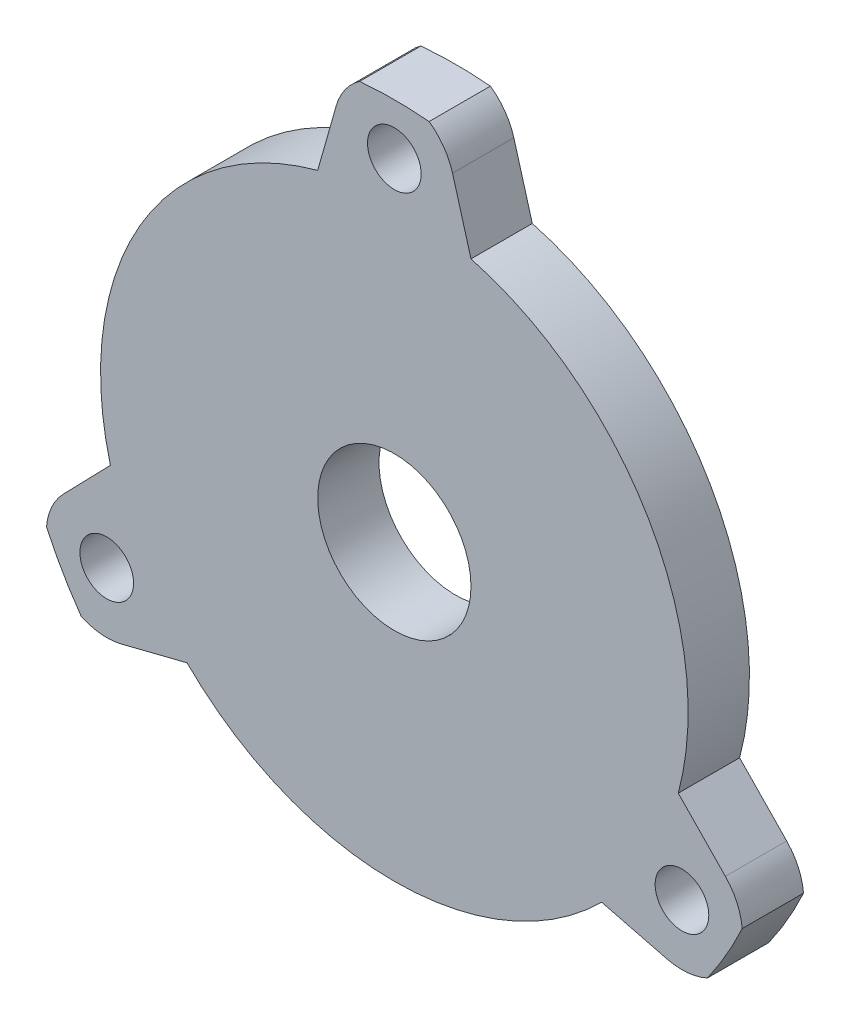
from build123d import *

# Parameters (mm, degrees)
ESBO_O1_R             = 75
ESBO_O1_R_2           = 15
EXTRUS_O1_DEPTH       = 6
ESBO_O2_R             = 5.25
CORTE_EXTRUS_O1_DEPTH = 107.742681248
CIRPATTERN1_COUNT     = 3
ESBO_O3_R             = 94.650975841
ESBO_O3_R_2           = 75
CORTE_EXTRUS_O3_DEPTH = 107.742681248


with BuildPart() as part:
    # Esboço1 → Extrusão1 (new, symmetric)
    with BuildSketch(Plane.XY):
        Circle(ESBO_O1_R)
        Circle(ESBO_O1_R_2, mode=Mode.SUBTRACT)
    extrude(amount=EXTRUS_O1_DEPTH, both=True)

    # Esboço2 → Corte-extrusão1 (cut, through all)
    with BuildSketch(Plane.XY.offset(6)):
        with Locations((0, 65)):
            Circle(ESBO_O2_R)
    corte_extrus_o1 = extrude(amount=-CORTE_EXTRUS_O1_DEPTH, mode=Mode.SUBTRACT)

    # CirPattern1: Corte-extrusão1 ×3 about axis
    cirpattern1_axis = Axis((0, 0, 0), (0, 0, 1))
    for i in range(1, CIRPATTERN1_COUNT):
        add(corte_extrus_o1.rotate(cirpattern1_axis, i * 360 / CIRPATTERN1_COUNT), mode=Mode.SUBTRACT)

    # Esboço3 → Corte-extrusão3 (cut, through all)
    # profile 1 of 4: a face of its own
    with BuildSketch(Plane.XY.offset(6)):
        Circle(ESBO_O3_R)
        Circle(ESBO_O3_R_2, mode=Mode.SUBTRACT)
    # profile 2 of 4: a face of its own
    with BuildSketch(Plane.XY.offset(6)):
        with BuildLine():
            ThreePointArc((-11.389775772, 68.231933262), (-9.651857518, 71.856677855), (-6.801268948, 74.690981656))
            ThreePointArc((-6.801268948, 74.690981656), (-64.951905284, 37.5), (-68.084922021, -31.455419141))
            ThreePointArc((-68.084922021, -31.455419141), (-67.055637213, -27.569585123), (-64.78547544, -24.252131468))
            Line((-64.78547544, -24.252131468), (-55.572211308, -14.764123082))
            ThreePointArc((-55.572211308, -14.764123082), (-49.796460718, 28.75), (-15, 55.509008278))
            Line((-15, 55.509008278), (-11.389775772, 68.231933262))
        make_face()
    # profile 3 of 4: a face of its own
    with BuildSketch(Plane.XY.offset(6)):
        with BuildLine():
            ThreePointArc((-53.395699668, -43.979801793), (-57.403779695, -44.287092732), (-61.283653073, -43.235562515))
            ThreePointArc((-61.283653073, -43.235562515), (0, -75), (61.283653073, -43.235562515))
            ThreePointArc((61.283653073, -43.235562515), (57.403779695, -44.287092732), (53.395699668, -43.979801793))
            Line((53.395699668, -43.979801793), (40.572211308, -40.744885196))
            ThreePointArc((40.572211308, -40.744885196), (0, -57.5), (-40.572211308, -40.744885196))
            Line((-40.572211308, -40.744885196), (-53.395699668, -43.979801793))
        make_face()
    # profile 4 of 4: a face of its own
    with BuildSketch(Plane.XY.offset(6)):
        with BuildLine():
            ThreePointArc((6.801268948, 74.690981656), (9.651857518, 71.856677855), (11.389775772, 68.231933262))
            Line((11.389775772, 68.231933262), (15, 55.509008278))
            ThreePointArc((15, 55.509008278), (45.654955919, 34.955328635), (57.5, 0))
            ThreePointArc((57.5, 0), (57.016015952, -7.444724636), (55.572211308, -14.764123082))
            Line((55.572211308, -14.764123082), (64.78547544, -24.252131468))
            ThreePointArc((64.78547544, -24.252131468), (67.055637213, -27.569585123), (68.084922021, -31.455419141))
            ThreePointArc((68.084922021, -31.455419141), (73.250833277, -16.10327371), (75, 0))
            ThreePointArc((75, 0), (55.385445611, 50.571260756), (6.801268948, 74.690981656))
        make_face()
    extrude(amount=-CORTE_EXTRUS_O3_DEPTH, mode=Mode.SUBTRACT)


solid = part.part
